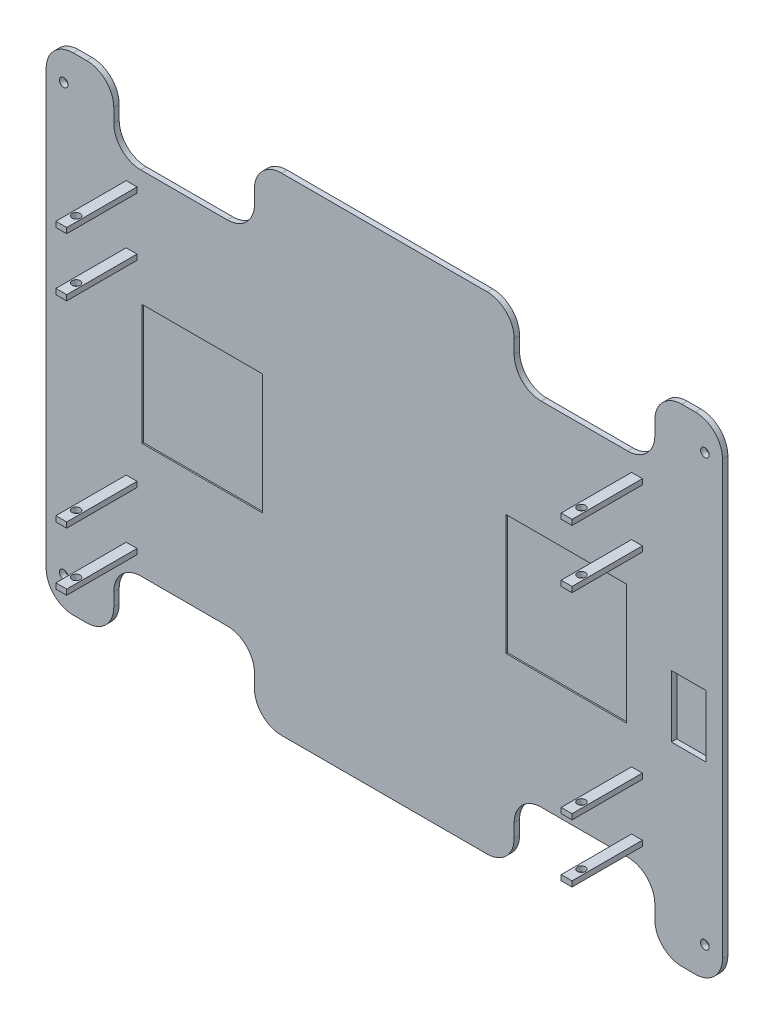
from build123d import *

# Parameters (mm, degrees)
ESQUISSE1_W              = 250
ESQUISSE1_H              = 180
BOSS_EXTRU_1_DEPTH       = 2
ESQUISSE2_W              = 52
ESQUISSE2_H              = 25
ENL_V_MAT_EXTRU_1_DEPTH  = 155.04220201
CONG_4_R                 = 10
ESQUISSE23_W             = 12.8
ESQUISSE23_H             = 22.9
ENL_V_MAT_EXTRU_13_DEPTH = 2
ESQUISSE24_W             = 44.5
ESQUISSE24_H             = 44.5
ENL_V_MAT_EXTRU_14_DEPTH = 0.5
ESQUISSE33_R             = 1.6
ENL_V_MAT_EXTRU_24_DEPTH = 155.04220201
ESQUISSE40_W             = 4
ESQUISSE40_H             = 2
BOSS_EXTRU_12_DEPTH      = 26
ESQUISSE41_R             = 1.5
ENL_V_MAT_EXTRU_25_DEPTH = 197.399427932
ESQUISSE42_W             = 12.8
ESQUISSE42_H             = 22.9
BOSS_EXTRU_13_DEPTH      = 5


with BuildPart() as part:
    # Esquisse1 → Boss.-Extru.1 (new body)
    with BuildSketch(Plane.XY):
        Rectangle(ESQUISSE1_W, ESQUISSE1_H)
    extrude(amount=BOSS_EXTRU_1_DEPTH)

    # Esquisse2 → Enlèv. mat.-Extru.1 (cut, through all)
    with BuildSketch(Plane.XY.offset(2)):
        with Locations((-74, 77.5)):
            Rectangle(ESQUISSE2_W, ESQUISSE2_H)
        with Locations((-74, -77.5)):
            Rectangle(ESQUISSE2_W, ESQUISSE2_H)
        with Locations((74, -77.5)):
            Rectangle(ESQUISSE2_W, ESQUISSE2_H)
        with Locations((74, 77.5)):
            Rectangle(ESQUISSE2_W, ESQUISSE2_H)
    extrude(amount=-ENL_V_MAT_EXTRU_1_DEPTH, mode=Mode.SUBTRACT)

    # Congé4
    cong_4_edges = [part.edges().sort_by_distance(p)[0] for p in [
        (-100, 90, 1),
        (-48, 90, 1),
        (-48, 65, 1),
        (-100, 65, 1),
        (100, 90, 1),
        (100, 65, 1),
        (48, 65, 1),
        (48, 90, 1),
        (48, -90, 1),
        (48, -65, 1),
        (100, -65, 1),
        (100, -90, 1),
        (-100, -90, 1),
        (-100, -65, 1),
        (-48, -65, 1),
        (-48, -90, 1),
        (-125, 90, 1),
        (125, 90, 1),
        (125, -90, 1),
        (-125, -90, 1),
    ]]
    fillet(cong_4_edges, radius=CONG_4_R)

    # Esquisse23 → Enlèv. mat.-Extru.13 (cut)
    with BuildSketch(Plane.XY.offset(2)):
        with Locations((112.526313531, -8.621941671)):
            Rectangle(ESQUISSE23_W, ESQUISSE23_H)
    extrude(amount=-ENL_V_MAT_EXTRU_13_DEPTH, mode=Mode.SUBTRACT)

    # Esquisse24 → Enlèv. mat.-Extru.14 (cut)
    with BuildSketch(Plane.XY.offset(2)):
        with Locations((-67.310804376, -0.05)):
            Rectangle(ESQUISSE24_W, ESQUISSE24_H)
        with Locations((67.310804376, -0.05)):
            Rectangle(ESQUISSE24_W, ESQUISSE24_H)
    extrude(amount=-ENL_V_MAT_EXTRU_14_DEPTH, mode=Mode.SUBTRACT)

    # Esquisse33 → Enlèv. mat.-Extru.24 (cut, through all)
    with BuildSketch(Plane.XY.offset(2)):
        with Locations((-118.505743781, 78.762079404)):
            Circle(ESQUISSE33_R)
        with Locations((118.505743781, 78.762079404)):
            Circle(ESQUISSE33_R)
        with Locations((118.505743781, -78.762079404)):
            Circle(ESQUISSE33_R)
        with Locations((-118.505743781, -78.762079404)):
            Circle(ESQUISSE33_R)
    extrude(amount=-ENL_V_MAT_EXTRU_24_DEPTH, mode=Mode.SUBTRACT)

    # Esquisse40 → Boss.-Extru.12 (add)
    with BuildSketch(Plane.XY.offset(2)):
        with Locations((-93.4, -57.874898126)):
            Rectangle(ESQUISSE40_W, ESQUISSE40_H)
        with Locations((-93.4, -36.374898126)):
            Rectangle(ESQUISSE40_W, ESQUISSE40_H)
        with Locations((-93.4, 36.374898126)):
            Rectangle(ESQUISSE40_W, ESQUISSE40_H)
        with Locations((-93.4, 57.874898126)):
            Rectangle(ESQUISSE40_W, ESQUISSE40_H)
        with Locations((93.4, 57.874898126)):
            Rectangle(ESQUISSE40_W, ESQUISSE40_H)
        with Locations((93.4, 36.374898126)):
            Rectangle(ESQUISSE40_W, ESQUISSE40_H)
        with Locations((93.4, -36.374898126)):
            Rectangle(ESQUISSE40_W, ESQUISSE40_H)
        with Locations((93.4, -57.874898126)):
            Rectangle(ESQUISSE40_W, ESQUISSE40_H)
    extrude(amount=BOSS_EXTRU_12_DEPTH)

    # Esquisse41 → Enlèv. mat.-Extru.25 (cut, through all)
    with BuildSketch(Plane.XZ.offset(58.874898126)):
        with Locations(Location((-93.4, 22.52, 0), (0, 0, 270))):
            Circle(ESQUISSE41_R)
        with Locations(Location((93.4, 22.52, 0), (0, 0, 270))):
            Circle(ESQUISSE41_R)
    extrude(amount=-ENL_V_MAT_EXTRU_25_DEPTH, mode=Mode.SUBTRACT)


with BuildPart() as body_2:
    # Esquisse42 → Boss.-Extru.13 (new body)
    with BuildSketch(Plane(origin=(0, 0, 0), x_dir=(-1, 0, 0), z_dir=(0, 0, -1))):
        with Locations((-112.526313531, -8.621941671)):
            Rectangle(ESQUISSE42_W, ESQUISSE42_H)
    extrude(amount=BOSS_EXTRU_13_DEPTH)


solid = Compound([part.part, body_2.part])
